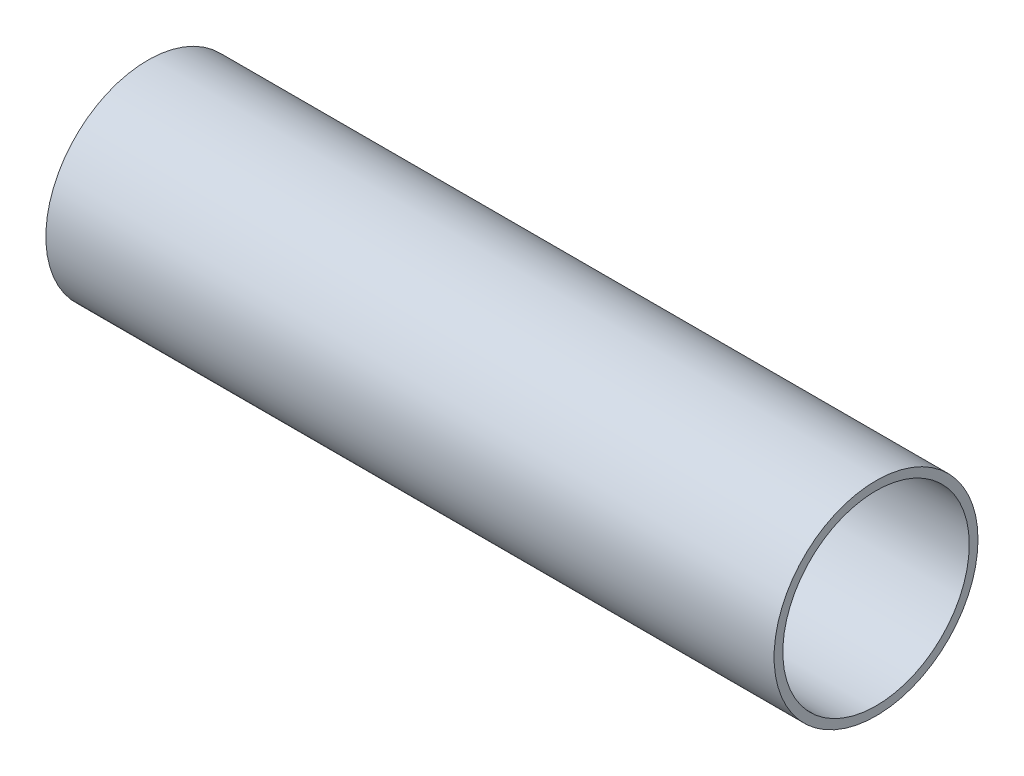
from build123d import *

# Parameters (mm, degrees)
SKETCH3_R           = 35
SKETCH3_R_2         = 32
BOSS_EXTRUDE1_DEPTH = 250


with BuildPart() as part:
    # Sketch3 → Boss-Extrude1 (new body)
    with BuildSketch(Plane(origin=(0, 0, 0), x_dir=(0, 0, -1), z_dir=(1, 0, 0))):
        Circle(SKETCH3_R)
        Circle(SKETCH3_R_2, mode=Mode.SUBTRACT)
    extrude(amount=BOSS_EXTRUDE1_DEPTH)


solid = part.part
